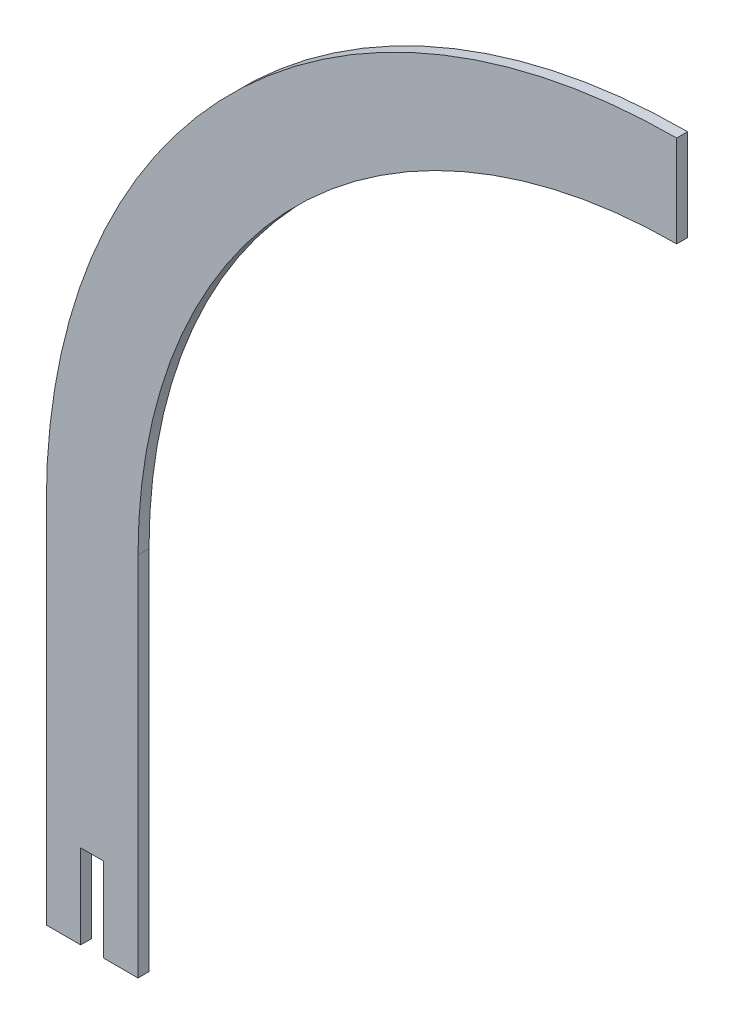
from build123d import *

# Parameters (mm, degrees)
BOSS_EXTRUDE1_DEPTH = 18.25625


with BuildPart() as part:
    # Sketch1 → Boss-Extrude1 (new body)
    with BuildSketch(Plane.XY):
        with BuildLine():
            ThreePointArc((-368.315070695, 1468.660053657), (-1109.186200683, 1161.781183645), (-1416.065070695, 420.910053657))
            Line((-1416.065070695, 420.910053657), (-1416.065070695, -188.062492737))
            Line((-1416.065070695, -188.062492737), (-1358.915070695, -188.062492737))
            Line((-1358.915070695, -188.062492737), (-1358.915070695, -48.362492737))
            Line((-1358.915070695, -48.362492737), (-1320.815070695, -48.362492737))
            Line((-1320.815070695, -48.362492737), (-1320.815070695, -188.062492737))
            Line((-1320.815070695, -188.062492737), (-1263.665070695, -188.062492737))
            Line((-1263.665070695, -188.062492737), (-1263.665070695, 420.910053657))
            ThreePointArc((-1263.665070695, 420.910053657), (-1001.42312723, 1054.018110192), (-368.315070695, 1316.260053657))
            Line((-368.315070695, 1316.260053657), (-368.315070695, 1468.660053657))
        make_face()
    extrude(amount=BOSS_EXTRUDE1_DEPTH)


solid = part.part
